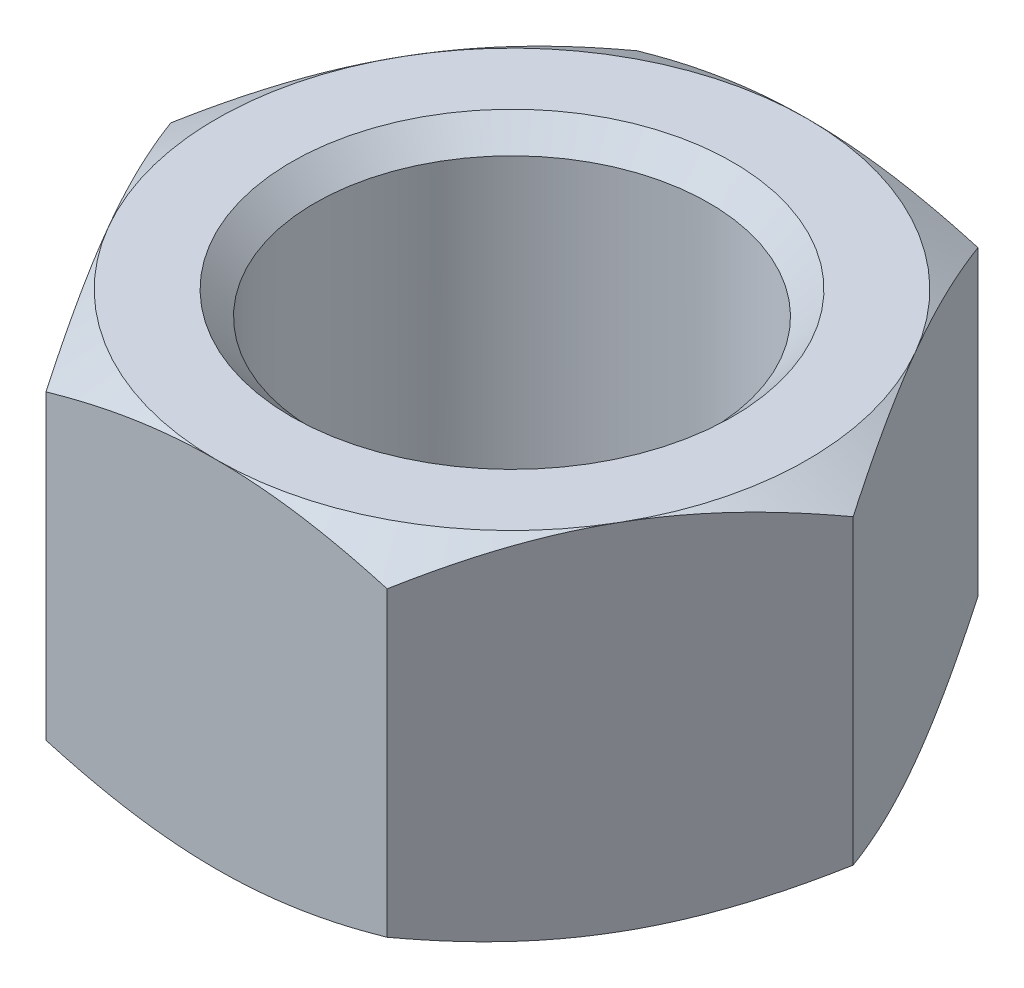
from build123d import *

# Parameters (mm, degrees)
EXTRUDE_1_DEPTH     = 9
SKETCH_2_R          = 10
CUT_EXTRUDE_1_DEPTH = 30.137604569
CHAMFER_1_SIZE      = 1.2


with BuildPart() as part:
    # 草图1 → 凸台-拉伸1 (new, symmetric)
    with BuildSketch(Plane(origin=(0, 0, 0), x_dir=(1, 0, 0), z_dir=(0, 1, 0))):
        Polygon((17.320508076, 0), (8.660254038, 15), (-8.660254038, 15), (-17.320508076, 0), (-8.660254038, -15), (8.660254038, -15), align=None)
    extrude(amount=EXTRUDE_1_DEPTH, both=True)

    # 草图2 → 切除-拉伸1 (cut, through all)
    with BuildSketch(Plane(origin=(0, 9, 0), x_dir=(1, 0, 0), z_dir=(0, 1, 0))):
        with Locations(Location((0, 0, 0), (0, 0, 270))):
            Circle(SKETCH_2_R)
    extrude(amount=-CUT_EXTRUDE_1_DEPTH, mode=Mode.SUBTRACT)

    # 倒角1
    chamfer_1_edges = [part.edges().sort_by_distance(p)[0] for p in [
        (0, -9, -10),
        (0, 9, -10),
    ]]
    chamfer(chamfer_1_edges, length=CHAMFER_1_SIZE)

    # 草图3 → 切除-旋转1 (revolve, cut)
    with BuildSketch(Plane.XY, mode=Mode.PRIVATE) as cut_revolve_1_sk:
        Polygon((17.320508076, 9), (15, 9), (17.320508076, 7.660254038), align=None)
    cut_revolve_1 = revolve(cut_revolve_1_sk.sketch.rotate(Axis((0, 9, 0), (0, -1, 0)), 270), axis=Axis((0, 9, 0), (0, -1, 0)), mode=Mode.SUBTRACT)

    # 镜向1: 切除-旋转1 across plane
    add(cut_revolve_1.mirror(Plane.ZX), mode=Mode.SUBTRACT)


solid = part.part
